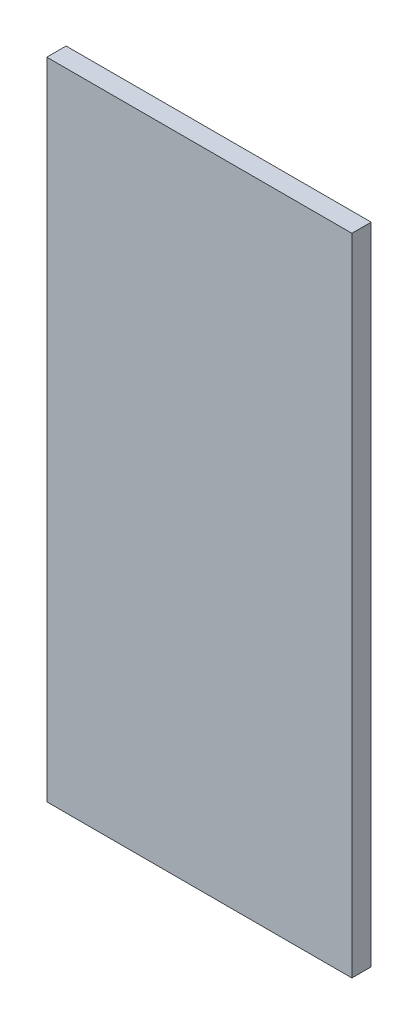
from build123d import *

# Parameters (mm, degrees)
SKETCH1_W           = 790
SKETCH1_H           = 1670
BOSS_EXTRUDE1_DEPTH = 50


with BuildPart() as part:
    # Sketch1 → Boss-Extrude1 (new body)
    with BuildSketch(Plane.XY):
        with Locations((0, 485)):
            Rectangle(SKETCH1_W, SKETCH1_H)
    extrude(amount=BOSS_EXTRUDE1_DEPTH)


solid = part.part
